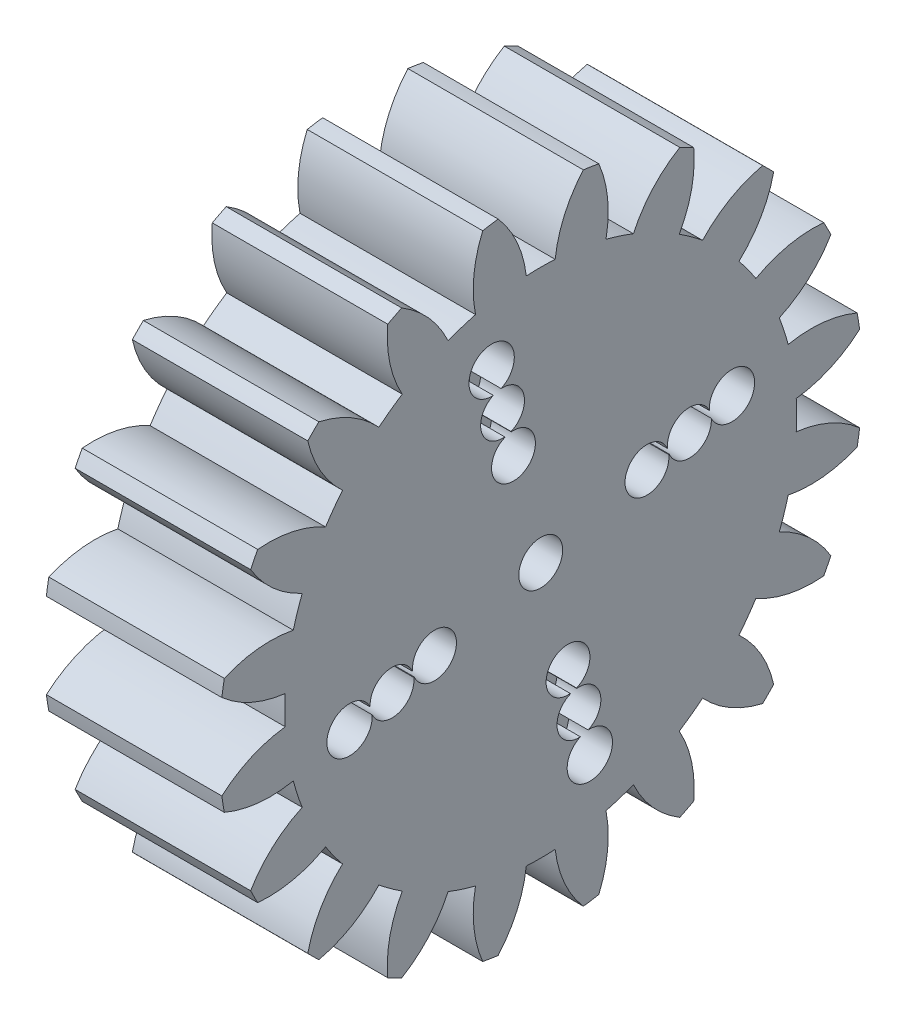
from build123d import *

# Parameters (mm, degrees)
BASPROSKE_W        = 12
BASPROSKE_H        = 22
TOOTHCUT_DEPTH     = 34.346664001
TEETHCUTS_COUNT    = 20
TEETHCUTS_ANGLE    = 342
BORSKE_R           = 1.5
BORE_DEPTH         = 50.0000508
SKETCH1_R          = 0.75
CUT_EXTRUDE1_DEPTH = 12
CUT_EXTRUDE2_DEPTH = 3
CIRPATTERN1_COUNT  = 4


with BuildPart() as part:
    # BasProSke → Base-Revolve (revolve)
    with BuildSketch(Plane(origin=(0, 0, 0), x_dir=(1, 0, 0), z_dir=(0, 1, 0)), mode=Mode.PRIVATE) as base_revolve_sk:
        with Locations((6, 11)):
            Rectangle(BASPROSKE_W, BASPROSKE_H)
    revolve(base_revolve_sk.sketch.rotate(Axis((-10, 0, 0), (1, 0, 0)), 180), axis=Axis((-10, 0, 0), (1, 0, 0)))

    # TooCutSke → ToothCut (cut, through all)
    with BuildSketch(Plane(origin=(0, 0, 0), x_dir=(0, 0, -1), z_dir=(1, 0, 0))):
        with BuildLine():
            ThreePointArc((0.986171591, 17.471189616), (0, 17.499), (-0.986171591, 17.471189616))
            ThreePointArc((-0.986171591, 17.471189616), (-1.626916196, 19.798789858), (-2.932850173, 21.829260982))
            ThreePointArc((-2.932850173, 21.829260982), (0, 22.0254), (2.932850173, 21.829260982))
            ThreePointArc((2.932850173, 21.829260982), (1.626916196, 19.798789858), (0.986171591, 17.471189616))
        make_face()
    toothcut = extrude(amount=TOOTHCUT_DEPTH, mode=Mode.SUBTRACT)

    # TeethCuts: ToothCut ×20 about axis
    teethcuts_axis = Axis((-10, 0, 0), (1, 0, 0))
    for i in range(1, TEETHCUTS_COUNT):
        add(toothcut.rotate(teethcuts_axis, i * TEETHCUTS_ANGLE / (TEETHCUTS_COUNT - 1)), mode=Mode.SUBTRACT)

    # BorSke → Bore (cut, symmetric)
    with BuildSketch(Plane(origin=(0, 0, 0), x_dir=(0, 0, -1), z_dir=(1, 0, 0))):
        with Locations(Location((0, 0, 0), (0, 0, 180))):
            Circle(BORSKE_R)
    extrude(amount=BORE_DEPTH, both=True, mode=Mode.SUBTRACT)

    # Sketch1 → Cut-Extrude1 (cut)
    with BuildSketch(Plane(origin=(12, 0, 0), x_dir=(0, 0, -1), z_dir=(1, 0, 0))):
        with Locations((-3.356833967, 13.075995783)):
            Circle(SKETCH1_R)
        with Locations((-2.610870863, 10.170218942)):
            Circle(SKETCH1_R)
        with Locations((10.170218942, 2.610870863)):
            Circle(SKETCH1_R)
        with Locations((13.075995783, 3.356833967)):
            Circle(SKETCH1_R)
        with Locations((-7.264442102, -1.864907759)):
            Circle(SKETCH1_R)
        with Locations((-10.170218942, -2.610870863)):
            Circle(SKETCH1_R)
        with Locations((1.864907759, -7.264442102)):
            Circle(SKETCH1_R)
        with Locations((3.356833967, -13.075995783)):
            Circle(SKETCH1_R)
        with Locations((-1.864907759, 7.264442102)):
            Circle(SKETCH1_R)
        with Locations((7.264442102, 1.864907759)):
            Circle(SKETCH1_R)
        with Locations((-13.075995783, -3.356833967)):
            Circle(SKETCH1_R)
        with Locations((2.610870863, -10.170218942)):
            Circle(SKETCH1_R)
    extrude(amount=-CUT_EXTRUDE1_DEPTH, mode=Mode.SUBTRACT)

    # Sketch1<3> → Cut-Extrude2 (cut)
    with BuildSketch(Plane(origin=(12, 0, 0), x_dir=(0, 0, -1), z_dir=(1, 0, 0))):
        with BuildLine():
            Line((-2.460152648, 8.677810145), (-2.447111692, 8.646845292))
            ThreePointArc((-2.447111692, 8.646845292), (-1.491875211, 5.811566774), (-2.020691692, 8.756330625))
            Line((-2.020691692, 8.756330625), (-2.033064445, 8.785971947))
            ThreePointArc((-2.033064445, 8.785971947), (-1.150777462, 10.513915407), (-2.71120657, 11.666859429))
            ThreePointArc((-2.71120657, 11.666859429), (-3.742248237, 14.577313817), (-3.24385833, 11.530118522))
            ThreePointArc((-3.24385833, 11.530118522), (-4.057266963, 9.772804395), (-2.460152648, 8.677810145))
        make_face()
    cut_extrude2 = extrude(amount=-CUT_EXTRUDE2_DEPTH, mode=Mode.SUBTRACT)

    # CirPattern1: Cut-Extrude2 ×4 about axis
    cirpattern1_axis = Axis((0, 0, 0), (1, 0, 0))
    for i in range(1, CIRPATTERN1_COUNT):
        add(cut_extrude2.rotate(cirpattern1_axis, i * 360 / CIRPATTERN1_COUNT), mode=Mode.SUBTRACT)


solid = part.part
